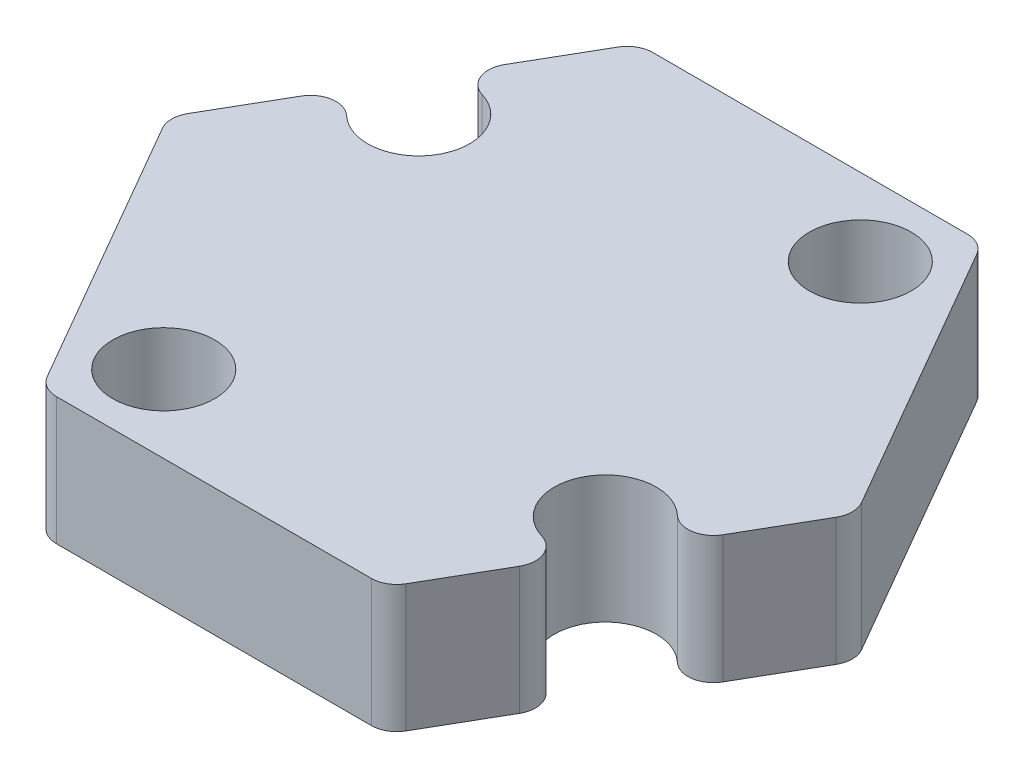
from build123d import *

# Parameters (mm, degrees)
EXTRUDE_1_DEPTH     = 5
FILLET_1_R          = 1
SKETCH_2_R          = 2
CUT_EXTRUDE_1_DEPTH = 10
FILLET_2_R          = 1


with BuildPart() as part:
    # Эскиз1 → Бобышка-Вытянуть1 (new body)
    with BuildSketch(Plane(origin=(0, 0, 0), x_dir=(1, 0, 0), z_dir=(0, 1, 0))):
        Polygon((13.5, 0), (6.75, 11.691342951), (-6.75, 11.691342951), (-13.5, 0), (-6.75, -11.691342951), (6.75, -11.691342951), align=None)
    extrude(amount=EXTRUDE_1_DEPTH)

    # Скругление1
    fillet_1_edges = [part.edges().sort_by_distance(p)[0] for p in [
        (6.75, 2.5, 11.691342951),
        (-6.75, 2.5, 11.691342951),
        (-13.5, 2.5, 0),
        (-6.75, 2.5, -11.691342951),
        (6.75, 2.5, -11.691342951),
        (13.5, 2.5, 0),
    ]]
    fillet(fillet_1_edges, radius=FILLET_1_R)

    # Эскиз2 → Вырез-Вытянуть1 (cut)
    with BuildSketch(Plane(origin=(0, 5, 0), x_dir=(1, 0, 0), z_dir=(0, 1, 0))):
        with Locations(Location((5, 8.660254038, 0), (0, 0, 270))):
            Circle(SKETCH_2_R)
        with Locations((8.660254038, -5)):
            Circle(SKETCH_2_R)
        with Locations(Location((-5, -8.660254038, 0), (0, 0, 270))):
            Circle(SKETCH_2_R)
        with Locations((-8.660254038, 5)):
            Circle(SKETCH_2_R)
    extrude(amount=-CUT_EXTRUDE_1_DEPTH, mode=Mode.SUBTRACT)

    # Скругление2
    fillet_2_edges = [part.edges().sort_by_distance(p)[0] for p in [
        (-9.591296191, 2.5, -6.770073588),
        (-10.658703809, 2.5, -4.921269363),
        (9.591296191, 2.5, 6.770073588),
        (10.658703809, 2.5, 4.921269363),
    ]]
    fillet(fillet_2_edges, radius=FILLET_2_R)


solid = part.part
